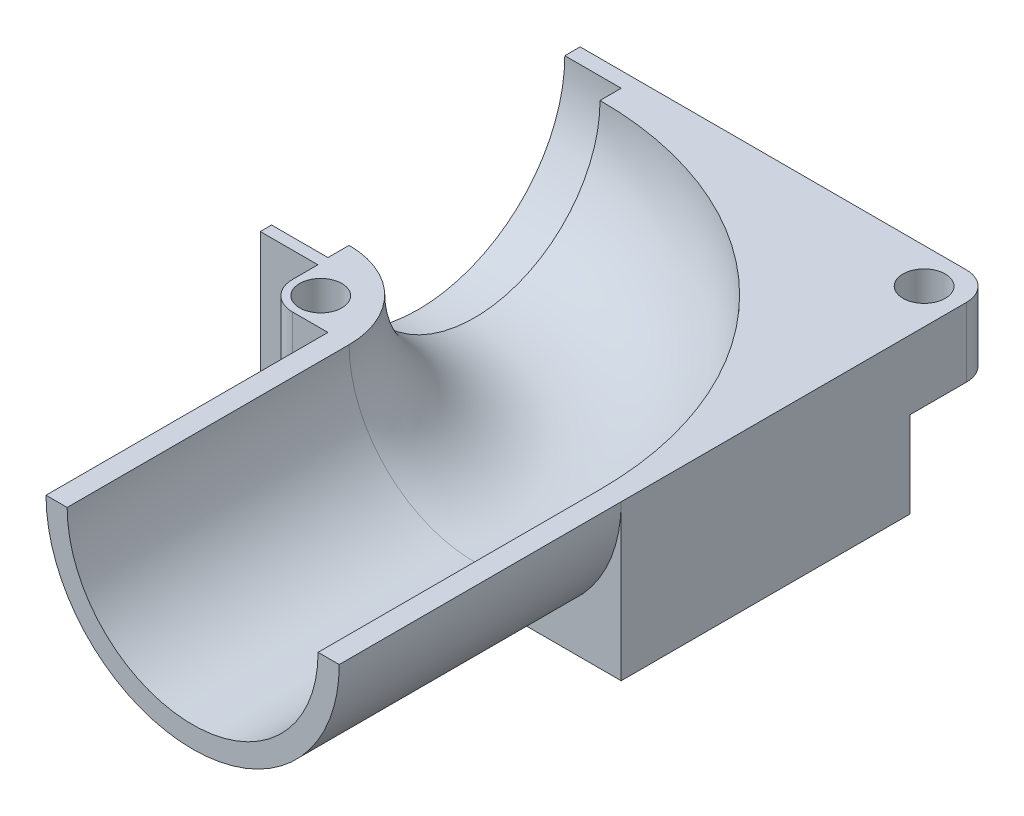
from build123d import *

# Parameters (mm, degrees)
SKETCH_2_W          = 31.839133497
SKETCH_2_H          = 39.485933834
EXTRUDE_1_DEPTH     = 11
CUT_EXTRUDE_1_DEPTH = 10
CUT_EXTRUDE_2_DEPTH = 4
CUT_EXTRUDE_3_DEPTH = 42.949140921
CUT_EXTRUDE_4_DEPTH = 6.1
SKETCH_8_R          = 1.5
CUT_EXTRUDE_5_DEPTH = 41.129291075
EXTRUDE_START       = 10
EXTRUDE_2_DEPTH     = 10


with BuildPart() as part:
    # 草图2 → 凸台-拉伸1 (new body)
    with BuildSketch(Plane(origin=(0, 0, 0), x_dir=(1, 0, 0), z_dir=(0, 1, 0))):
        with Locations((15.919566749, -5.257033083)):
            Rectangle(SKETCH_2_W, SKETCH_2_H)
    extrude(amount=EXTRUDE_1_DEPTH)

    # 切除-扫描1: sweep along a path in 草图1
    with BuildLine(Plane(origin=(0, 0, 0), x_dir=(1, 0, 0), z_dir=(0, 1, 0))) as sweep_1_path:
        Line((0, 0), (4, 0))
        ThreePointArc((4, 0), (14.606601718, -4.393398282), (19, -15))
        Line((19, -15), (19, -25))
    # 草图3 → 切除-扫描1 (sweep, cut)
    with BuildSketch(Plane.XY.offset(25)):
        with BuildLine():
            Line((10.1, 11), (27.9, 11))
            ThreePointArc((27.9, 11), (19, 2.1), (10.1, 11))
        make_face()
    sweep(path=sweep_1_path.line, mode=Mode.SUBTRACT)

    # 草图4 → 切除-拉伸1 (cut)
    with BuildSketch(Plane.XY.offset(25)):
        with BuildLine():
            Line((-2.109075954, 11), (8.6, 11))
            ThreePointArc((8.6, 11), (19, 0.6), (29.4, 11))
            Line((29.4, 11), (35.024958402, 11))
            Line((35.024958402, 11), (35.024958402, -3.577524268))
            Line((35.024958402, -3.577524268), (-2.109075954, -3.577524268))
            Line((-2.109075954, -3.577524268), (-2.109075954, 11))
        make_face()
    extrude(amount=-CUT_EXTRUDE_1_DEPTH, mode=Mode.SUBTRACT)

    # 草图5 → 切除-拉伸2 (cut)
    with BuildSketch(Plane(origin=(0, 0, 0), x_dir=(0, 0, -1), z_dir=(1, 0, 0))):
        with BuildLine():
            Line((10.4, 11), (-10.4, 11))
            ThreePointArc((-10.4, 11), (0, 0.6), (10.4, 11))
        make_face()
    extrude(amount=CUT_EXTRUDE_2_DEPTH, mode=Mode.SUBTRACT)

    # 草图6 → 切除-拉伸3 (cut, through all)
    with BuildSketch(Plane(origin=(0, 0, 0), x_dir=(1, 0, 0), z_dir=(0, 1, 0))):
        with BuildLine():
            Line((29.4, -15), (31.839133497, -15))
            Line((31.839133497, -15), (31.839133497, 14.485933834))
            Line((31.839133497, 14.485933834), (0, 14.485933834))
            Line((0, 14.485933834), (0, 11.485933834))
            Line((0, 11.485933834), (27.4, 11.485933834))
            ThreePointArc((27.4, 11.485933834), (28.814213562, 10.900147397), (29.4, 9.485933834))
            Line((29.4, 9.485933834), (29.4, -15))
        make_face()
        with BuildLine():
            Line((0, -11.2), (4.087386129, -11.2))
            Line((4.087386129, -11.2), (4.087386129, -13))
            ThreePointArc((4.087386129, -13), (4.673172567, -14.414213562), (6.087386129, -15))
            Line((6.087386129, -15), (0, -15))
            Line((0, -15), (0, -11.2))
        make_face()
    extrude(amount=CUT_EXTRUDE_3_DEPTH, mode=Mode.SUBTRACT)

    # 草图7 → 切除-拉伸4 (cut)
    with BuildSketch(Plane(origin=(0, 0, 0), x_dir=(1, 0, 0), z_dir=(0, 1, 0))):
        with BuildLine():
            Line((4.087386129, -10.708164804), (4.087386129, -13))
            ThreePointArc((4.087386129, -13), (4.673172567, -14.414213562), (6.087386129, -15))
            Line((6.087386129, -15), (8.6, -15))
            Line((8.6, -15), (8.6, -12.708164804))
            ThreePointArc((8.6, -12.708164804), (8.014213562, -11.293951241), (6.6, -10.708164804))
            Line((6.6, -10.708164804), (4.087386129, -10.708164804))
        make_face()
        with BuildLine():
            Line((23.4, 11.485933834), (27.4, 11.485933834))
            ThreePointArc((27.4, 11.485933834), (28.814213562, 10.900147397), (29.4, 9.485933834))
            Line((29.4, 9.485933834), (29.4, 5.485933834))
            Line((29.4, 5.485933834), (25.4, 5.485933834))
            ThreePointArc((25.4, 5.485933834), (23.985786438, 6.071720272), (23.4, 7.485933834))
            Line((23.4, 7.485933834), (23.4, 11.485933834))
        make_face()
    extrude(amount=CUT_EXTRUDE_4_DEPTH, mode=Mode.SUBTRACT)

    # 草图8 → 切除-拉伸5 (cut, through all)
    with BuildSketch(Plane(origin=(0, 0, 0), x_dir=(1, 0, 0), z_dir=(0, 1, 0))):
        with Locations(Location((6.087386129, -13, 0), (0, 0, 90))):
            Circle(SKETCH_8_R)
        with Locations(Location((26.9, 8.985933834, 0), (0, 0, 270))):
            Circle(SKETCH_8_R)
    extrude(amount=CUT_EXTRUDE_5_DEPTH, mode=Mode.SUBTRACT)

    # 草图9 → 凸台-拉伸2 (add)
    with BuildSketch(Plane.XY.offset(25).offset(EXTRUDE_START)):
        with BuildLine():
            Line((27.9, 11), (29.4, 11))
            ThreePointArc((29.4, 11), (19, 0.6), (8.6, 11))
            Line((8.6, 11), (10.1, 11))
            ThreePointArc((10.1, 11), (19, 2.1), (27.9, 11))
        make_face()
    extrude(amount=-EXTRUDE_2_DEPTH)


solid = part.part
